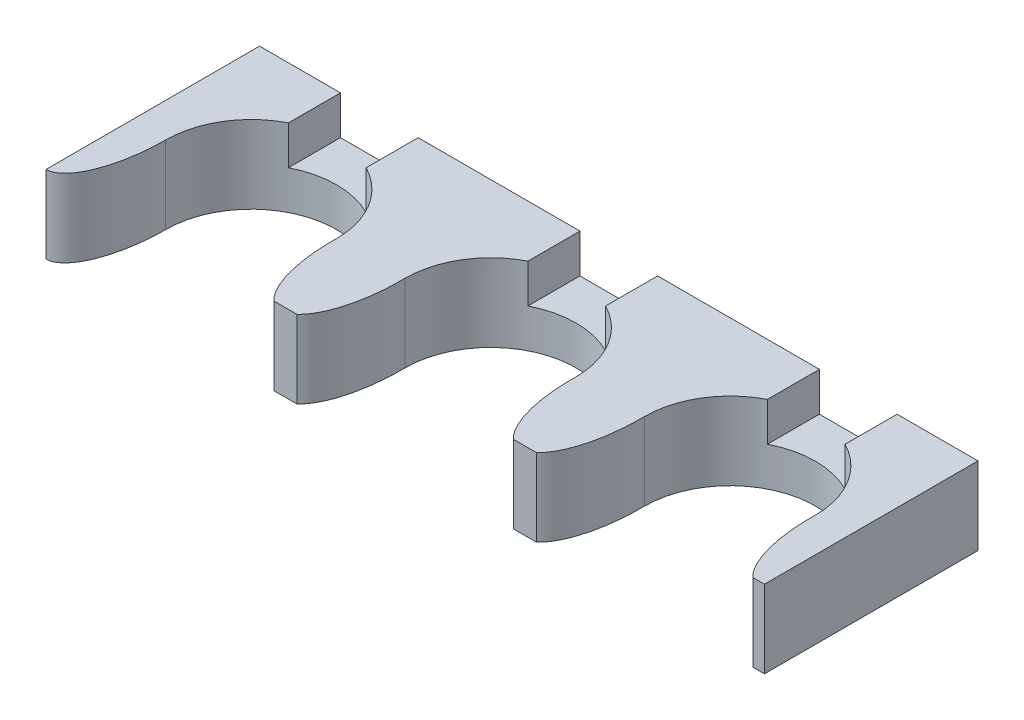
from build123d import *

# Parameters (mm, degrees)
SKETCH1_W           = 469.9
SKETCH1_H           = 139.7
BOSS_EXTRUDE1_DEPTH = 50.8
SKETCH2_R           = 55.88
CUT_EXTRUDE3_DEPTH  = 405.871109401
CUT_EXTRUDE5_DEPTH  = 405.871109401
SKETCH5_W           = 50.8
SKETCH5_H           = 25.4
CUT_EXTRUDE6_DEPTH  = 419.118003235


with BuildPart() as part:
    # Sketch1 → Boss-Extrude1 (new body)
    with BuildSketch(Plane(origin=(0, 0, 0), x_dir=(1, 0, 0), z_dir=(0, 1, 0))):
        with Locations((155.851656231, -22.96185654)):
            Rectangle(SKETCH1_W, SKETCH1_H)
    extrude(amount=BOSS_EXTRUDE1_DEPTH)

    # Sketch2 → Cut-Extrude3 (cut, through all)
    with BuildSketch(Plane(origin=(0, 50.8, 0), x_dir=(1, 0, 0), z_dir=(0, 1, 0))):
        with BuildLine():
            Line((55.098238231, -92.81185654), (55.098238231, -36.93185654))
            ThreePointArc((55.098238231, -36.93185654), (38.731365092, -76.444983544), (-0.781761972, -92.81185654))
            Line((-0.781761972, -92.81185654), (55.098238231, -92.81185654))
        make_face()
        with BuildLine():
            ThreePointArc((-0.781761972, -92.81185654), (-40.294888773, -76.4449834), (-56.661761769, -36.93185654))
            Line((-56.661761769, -36.93185654), (-56.661761769, -92.81185654))
            Line((-56.661761769, -92.81185654), (-0.781761972, -92.81185654))
        make_face()
        with BuildLine():
            Line((99.971656231, -36.93185654), (99.971656231, -92.81185654))
            Line((99.971656231, -92.81185654), (155.851656231, -92.81185654))
            ThreePointArc((155.851656231, -92.81185654), (116.338529299, -76.444983472), (99.971656231, -36.93185654))
        make_face()
        with BuildLine():
            ThreePointArc((211.731656231, -36.93185654), (195.364783164, -76.444983472), (155.851656231, -92.81185654))
            Line((155.851656231, -92.81185654), (211.731656231, -92.81185654))
            Line((211.731656231, -92.81185654), (211.731656231, -36.93185654))
        make_face()
        with BuildLine():
            Line((256.605074231, -36.93185654), (256.605074231, -92.81185654))
            Line((256.605074231, -92.81185654), (312.485074664, -92.81185654))
            ThreePointArc((312.485074664, -92.81185654), (272.971947451, -76.444983625), (256.605074231, -36.93185654))
        make_face()
        with BuildLine():
            ThreePointArc((368.365074231, -36.93185654), (351.998201317, -76.444983319), (312.485074664, -92.81185654))
            Line((312.485074664, -92.81185654), (368.365074231, -92.81185654))
            Line((368.365074231, -92.81185654), (368.365074231, -36.93185654))
        make_face()
        with Locations((312.485074231, -36.93185654)):
            Circle(SKETCH2_R)
        with Locations((155.851656231, -36.93185654)):
            Circle(SKETCH2_R)
        with Locations((-0.781761769, -36.93185654)):
            Circle(SKETCH2_R)
    extrude(amount=-CUT_EXTRUDE3_DEPTH, mode=Mode.SUBTRACT)

    # Sketch3 → Cut-Extrude5 (cut, through all)
    with BuildSketch(Plane(origin=(0, 50.8, 0), x_dir=(1, 0, 0), z_dir=(0, 1, 0))):
        with BuildLine():
            Line((-56.661761769, -92.81185654), (-56.661761769, -36.93185654))
            add(Edge.make_bspline(
                [(-79.098343769, -92.81185654), (-56.661761769, -92.81185654), (-56.661761769, -36.93185654)],
                knots=[0, 0, 0, 1.570796327, 1.570796327, 1.570796327], degree=2, weights=[1, 0.707106781, 1]))
            Line((-79.098343769, -92.81185654), (-56.661761769, -92.81185654))
        make_face()
        with BuildLine():
            add(Edge.make_bspline(
                [(55.098238231, -42.266592873), (55.687318095, -80.198521665), (70.062894281, -92.81185654)],
                knots=[4.75104815, 4.75104815, 4.75104815, 5.944468502, 5.944468502, 5.944468502], degree=2, weights=[1, 0.82718872, 1]))
            Line((55.098238231, -42.266592873), (55.098238231, -92.81185654))
            Line((55.098238231, -92.81185654), (70.062894281, -92.81185654))
        make_face()
        with BuildLine():
            Line((99.971656231, -36.93185654), (99.918392881, -36.93185654))
            add(Edge.make_bspline(
                [(84.973218182, -92.81185654), (100.8764169, -78.858163942), (99.918392881, -36.93185654)],
                knots=[0.338716805, 0.338716805, 0.338716805, 1.627645124, 1.627645124, 1.627645124], degree=2, weights=[1, 0.799421799, 1]))
            Line((84.973218182, -92.81185654), (99.971656231, -92.81185654))
            Line((99.971656231, -92.81185654), (99.971656231, -36.93185654))
        make_face()
        with BuildLine():
            add(Edge.make_bspline(
                [(211.731656231, -43.172150916), (212.553221033, -80.41743909), (226.679294281, -92.81185654)],
                knots=[4.767271474, 4.767271474, 4.767271474, 5.944468502, 5.944468502, 5.944468502], degree=2, weights=[1, 0.831719595, 1]))
            Line((211.731656231, -43.172150916), (211.731656231, -92.81185654))
            Line((211.731656231, -92.81185654), (226.679294281, -92.81185654))
        make_face()
        with BuildLine():
            Line((256.605074231, -36.93185654), (256.534792881, -36.93185654))
            add(Edge.make_bspline(
                [(241.589618182, -92.81185654), (257.4928169, -78.858163942), (256.534792881, -36.93185654)],
                knots=[0.338716805, 0.338716805, 0.338716805, 1.627645124, 1.627645124, 1.627645124], degree=2, weights=[1, 0.799421799, 1]))
            Line((241.589618182, -92.81185654), (256.605074231, -92.81185654))
            Line((256.605074231, -92.81185654), (256.605074231, -36.93185654))
        make_face()
        with BuildLine():
            add(Edge.make_bspline(
                [(368.365074231, -43.865048297), (369.358856755, -80.583477202), (383.295694281, -92.81185654)],
                knots=[4.779694469, 4.779694469, 4.779694469, 5.944468502, 5.944468502, 5.944468502], degree=2, weights=[1, 0.835152126, 1]))
            Line((368.365074231, -43.865048297), (368.365074231, -92.81185654))
            Line((368.365074231, -92.81185654), (383.295694281, -92.81185654))
        make_face()
    extrude(amount=-CUT_EXTRUDE5_DEPTH, mode=Mode.SUBTRACT)

    # Sketch5 → Cut-Extrude6 (cut, through all)
    with BuildSketch(Plane(origin=(0, 0, -46.88814346), x_dir=(-1, 0, 0), z_dir=(0, 0, -1))):
        with Locations((-312.485836231, 38.1)):
            Rectangle(SKETCH5_W, SKETCH5_H)
        with Locations((-155.851656231, 38.1)):
            Rectangle(SKETCH5_W, SKETCH5_H)
        with Locations((0.782523769, 38.1)):
            Rectangle(SKETCH5_W, SKETCH5_H)
    extrude(amount=-CUT_EXTRUDE6_DEPTH, mode=Mode.SUBTRACT)


solid = part.part
